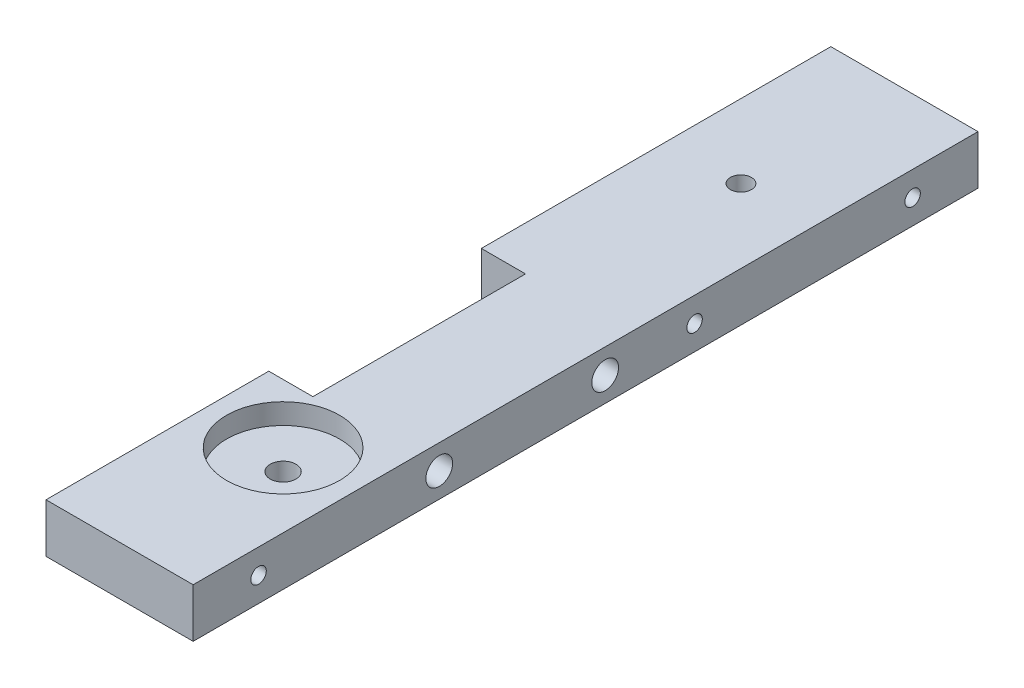
from build123d import *

# Parameters (mm, degrees)
SKETCH2_W             = 28.575
SKETCH2_H             = 152.4
BOSS_EXTRUDE1_DEPTH   = 9.525
F_3_0MM_DOWEL_HOLE1_D = 3
LPATTERN1_COUNT       = 4
LPATTERN1_PITCH       = 42.333333333
SKETCH12_R            = 2.05
CUT_EXTRUDE1_DEPTH    = 156.348048749
SKETCH12_4_R          = 10.975
CUT_EXTRUDE2_DEPTH    = 4
SKETCH15_R            = 2.5
CUT_EXTRUDE3_DEPTH    = 156.154169296
SKETCH13_R            = 2.6
CUT_EXTRUDE4_DEPTH    = 156.348048749
SKETCH17_W            = 41.28
SKETCH17_H            = 9.525
CUT_EXTRUDE5_DEPTH    = 8.575


with BuildPart() as part:
    # Sketch2 → Boss-Extrude1 (new body)
    with BuildSketch(Plane(origin=(0, 0, 0), x_dir=(1, 0, 0), z_dir=(0, 1, 0))):
        with Locations((14.2875, 76.2)):
            Rectangle(SKETCH2_W, SKETCH2_H)
    extrude(amount=BOSS_EXTRUDE1_DEPTH)

    # Ø3.0mm Dowel Hole1 (through all)
    with Locations(Plane.ZY):
        with Locations((-139.7, 4.7625)):
            f_3_0mm_dowel_hole1 = Hole(F_3_0MM_DOWEL_HOLE1_D / 2)

    # LPattern1: Ø3.0mm Dowel Hole1 ×4, 1 skipped
    with Locations(*[(0, 0, i * LPATTERN1_PITCH) for i in range(1, LPATTERN1_COUNT) if i not in (2,)]):
        add(f_3_0mm_dowel_hole1, mode=Mode.SUBTRACT)

    # Sketch12 → Cut-Extrude1 (cut, through all)
    with BuildSketch(Plane(origin=(0, 9.525, 0), x_dir=(1, 0, 0), z_dir=(0, 1, 0))):
        with Locations(Location((14.2875, 120.65, 0), (0, 0, 270))):
            Circle(SKETCH12_R)
    extrude(amount=-CUT_EXTRUDE1_DEPTH, mode=Mode.SUBTRACT)

    # Sketch12<4> → Cut-Extrude2 (cut)
    with BuildSketch(Plane(origin=(0, 9.525, 0), x_dir=(1, 0, 0), z_dir=(0, 1, 0))):
        with Locations(Location((14.2875, 31.75, 0), (0, 0, 270))):
            Circle(SKETCH12_4_R)
    extrude(amount=-CUT_EXTRUDE2_DEPTH, mode=Mode.SUBTRACT)

    # Sketch15 → Cut-Extrude3 (cut, through all)
    with BuildSketch(Plane(origin=(0, 5.525, 0), x_dir=(1, 0, 0), z_dir=(0, 1, 0))):
        with Locations(Location((14.2875, 31.75, 0), (0, 0, 270))):
            Circle(SKETCH15_R)
    extrude(amount=-CUT_EXTRUDE3_DEPTH, mode=Mode.SUBTRACT)

    # Sketch13 → Cut-Extrude4 (cut, through all)
    with BuildSketch(Plane.ZY):
        with Locations((-80, 4.7625)):
            Circle(SKETCH13_R)
        with Locations((-47.79, 4.7625)):
            Circle(SKETCH13_R)
    extrude(amount=-CUT_EXTRUDE4_DEPTH, mode=Mode.SUBTRACT)

    # Sketch17 → Cut-Extrude5 (cut)
    with BuildSketch(Plane.ZY):
        with Locations((-63.895, 4.7625)):
            Rectangle(SKETCH17_W, SKETCH17_H)
    extrude(amount=-CUT_EXTRUDE5_DEPTH, mode=Mode.SUBTRACT)


solid = part.part
